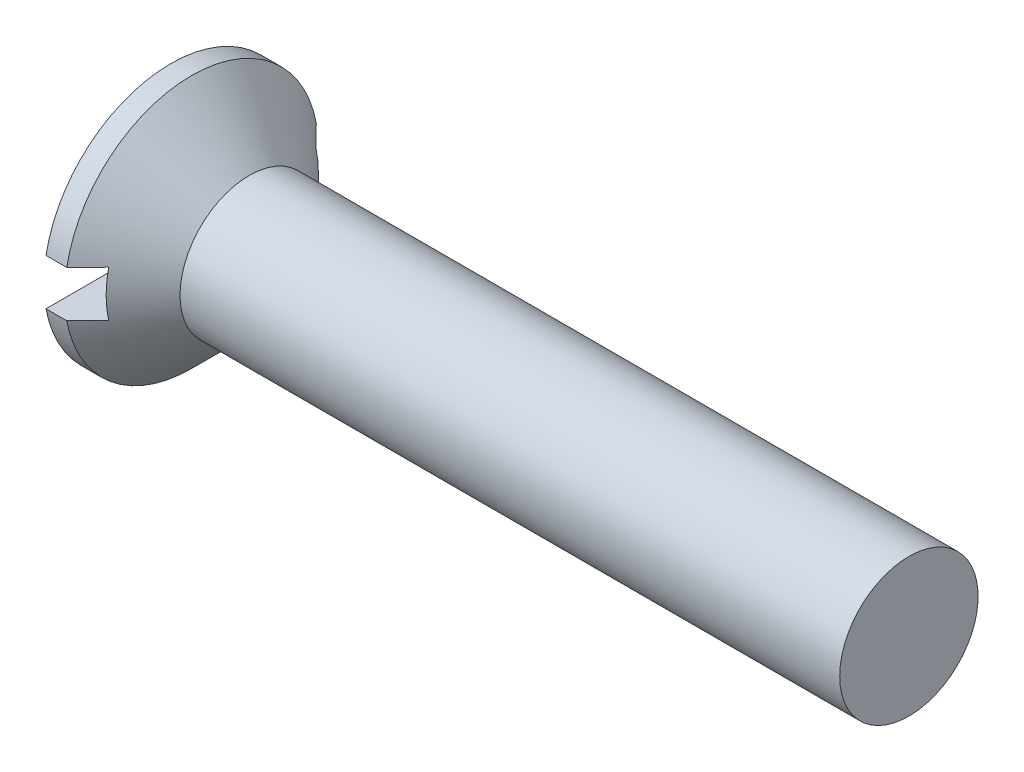
from build123d import *

# Parameters (mm, degrees)
SKETCH2_W  = 5.5
SKETCH2_H  = 1
SLOT_DEPTH = 0.9


with BuildPart() as part:
    # BodySke → Base-Revolve (revolve)
    with BuildSketch(Plane.XY, mode=Mode.PRIVATE) as base_revolve_sk:
        Polygon((0, 0), (0, 2.75), (0.45, 2.75), (1.7, 1.5), (16, 1.5), (16, 0), align=None)
    revolve(base_revolve_sk.sketch.rotate(Axis((-6.35, 0, 0), (1, 0, 0)), 90), axis=Axis((-6.35, 0, 0), (1, 0, 0)))

    # Sketch2 → Slot (cut)
    with BuildSketch(Plane.ZY):
        Rectangle(SKETCH2_W, SKETCH2_H)
    extrude(amount=-SLOT_DEPTH, mode=Mode.SUBTRACT)


solid = part.part
